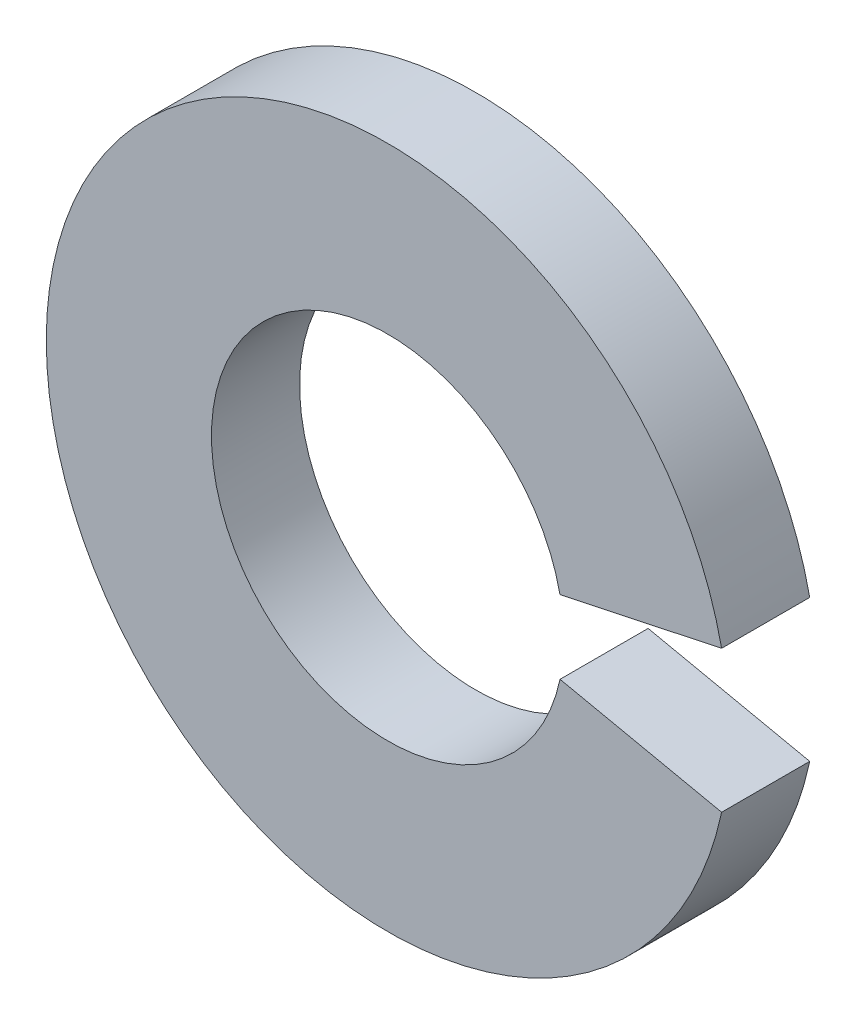
from build123d import *

# Parameters (mm, degrees)
EXTRUDE_1_DEPTH = 0.4


with BuildPart() as part:
    # 草图1 → 凸台-拉伸1 (new, symmetric)
    with BuildSketch(Plane.XY):
        with BuildLine():
            Line((3.032257562, -0.644526242), (1.565036161, -0.332658705))
            ThreePointArc((1.565036161, -0.332658705), (-1.6, 0), (1.565036161, 0.332658705))
            Line((1.565036161, 0.332658705), (3.032257562, 0.644526242))
            ThreePointArc((3.032257562, 0.644526242), (-3.1, 0), (3.032257562, -0.644526242))
        make_face()
    extrude(amount=EXTRUDE_1_DEPTH, both=True)


solid = part.part
